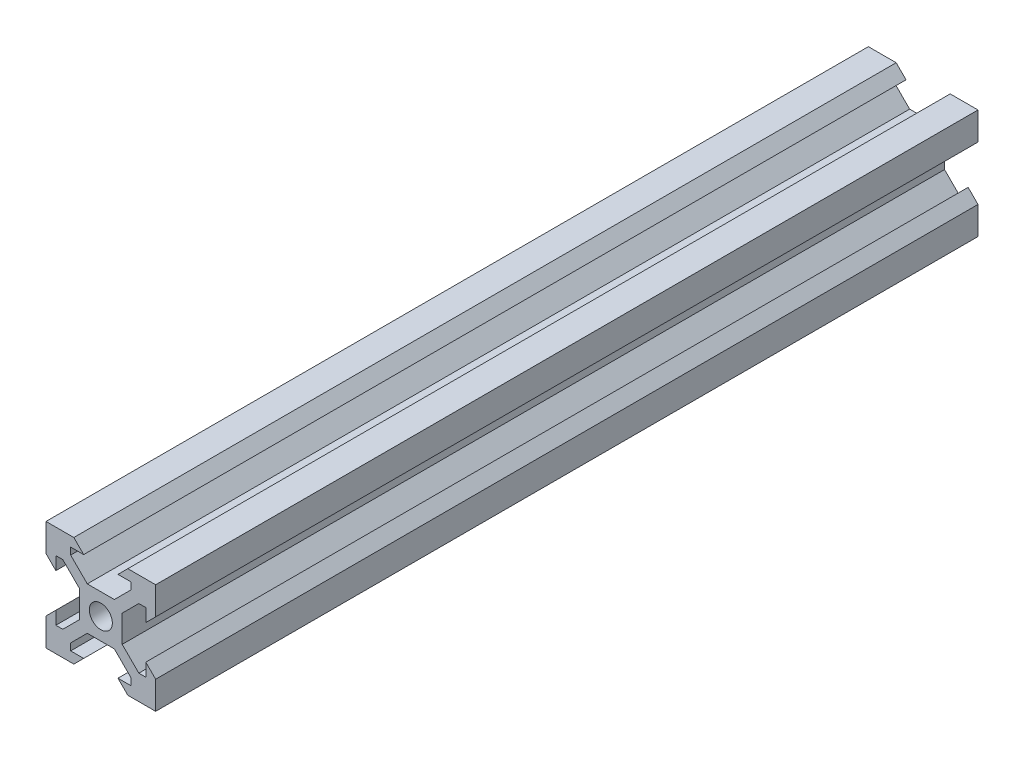
from build123d import *

# Parameters (mm, degrees)
SKETCH1_R           = 2.1
BOSS_EXTRUDE1_DEPTH = 75


with BuildPart() as part:
    # Sketch1 → Boss-Extrude1 (new, symmetric)
    with BuildSketch(Plane.XY):
        Polygon((-10, -4.925), (-10, -10), (-4.925, -10), (-3.125, -8.2), (-5.5, -8.2), (-5.5, -6.933181517), (-2.466818483, -3.9), (2.466818483, -3.9), (5.5, -6.933181517), (5.5, -8.2), (3.125, -8.2), (4.925, -10), (10, -10), (10, -4.925), (8.2, -3.125), (8.2, -5.5), (6.933181517, -5.5), (3.9, -2.466818483), (3.9, 2.466818483), (6.933181517, 5.5), (8.2, 5.5), (8.2, 3.125), (10, 4.925), (10, 10), (4.925, 10), (3.125, 8.2), (5.5, 8.2), (5.5, 6.933181517), (2.466818483, 3.9), (-2.466818483, 3.9), (-5.5, 6.933181517), (-5.5, 8.2), (-3.125, 8.2), (-4.925, 10), (-10, 10), (-10, 4.925), (-8.2, 3.125), (-8.2, 5.5), (-6.933181517, 5.5), (-3.9, 2.466818483), (-3.9, -2.466818483), (-6.933181517, -5.5), (-8.2, -5.5), (-8.2, -3.125), align=None)
        Circle(SKETCH1_R, mode=Mode.SUBTRACT)
    extrude(amount=BOSS_EXTRUDE1_DEPTH, both=True)


solid = part.part
